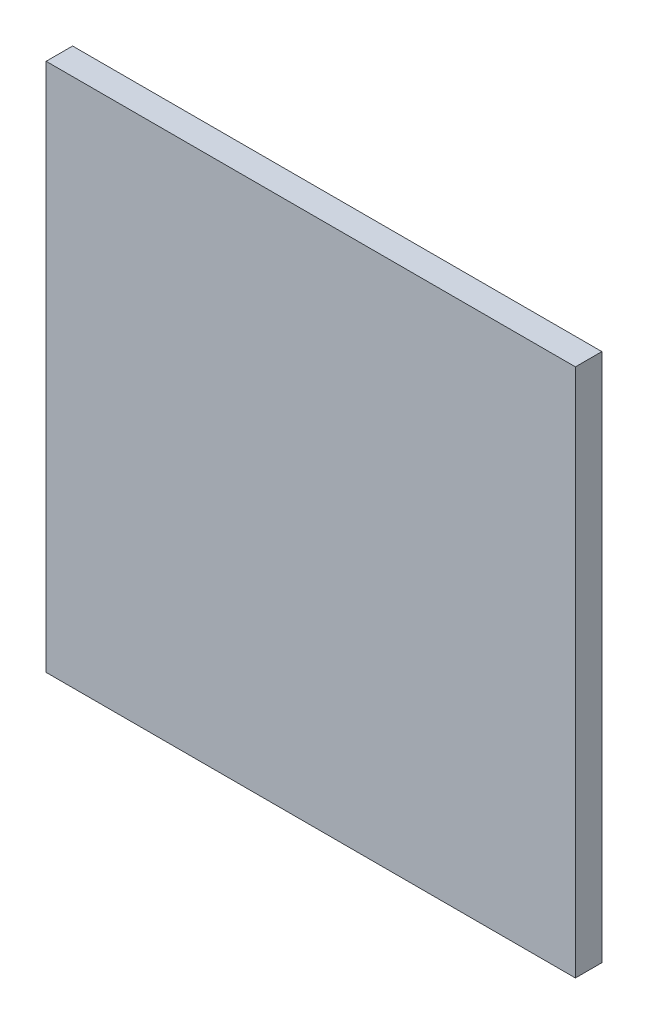
from build123d import *

# Parameters (mm, degrees)
SKETCH1_W      = 508
SKETCH1_H      = 508
EXTRUDE1_DEPTH = 25.4


with BuildPart() as part:
    # Sketch1 → Extrude1 (new body)
    with BuildSketch(Plane.XY):
        with Locations((254, 254)):
            Rectangle(SKETCH1_W, SKETCH1_H)
    extrude(amount=-EXTRUDE1_DEPTH)


solid = part.part
